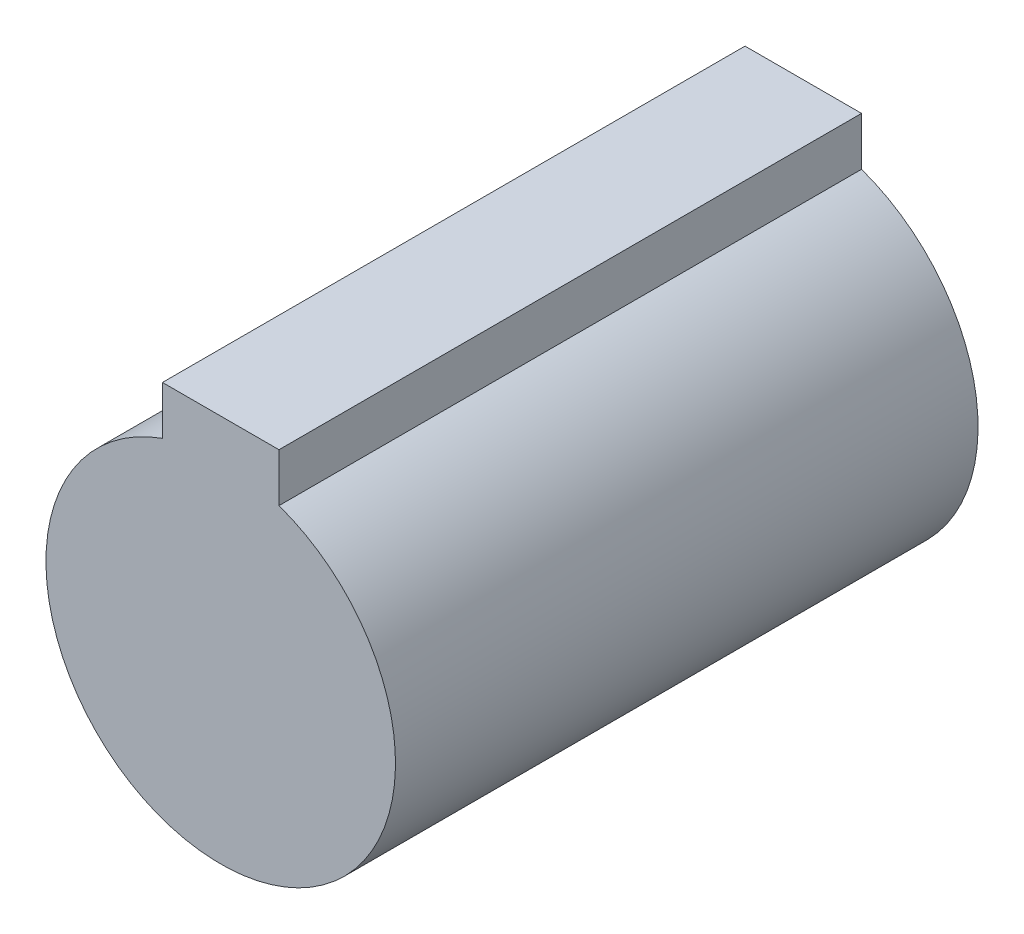
from build123d import *

# Parameters (mm, degrees)
BOSS_EXTRUDE1_DEPTH = 50


with BuildPart() as part:
    # Sketch1 → Boss-Extrude1 (new body)
    with BuildSketch(Plane.XY):
        with BuildLine():
            Line((-5, 14.142135624), (-5, 18.3))
            Line((-5, 18.3), (5, 18.3))
            Line((5, 18.3), (5, 14.142135624))
            ThreePointArc((5, 14.142135624), (0, -15), (-5, 14.142135624))
        make_face()
    extrude(amount=BOSS_EXTRUDE1_DEPTH)


solid = part.part
